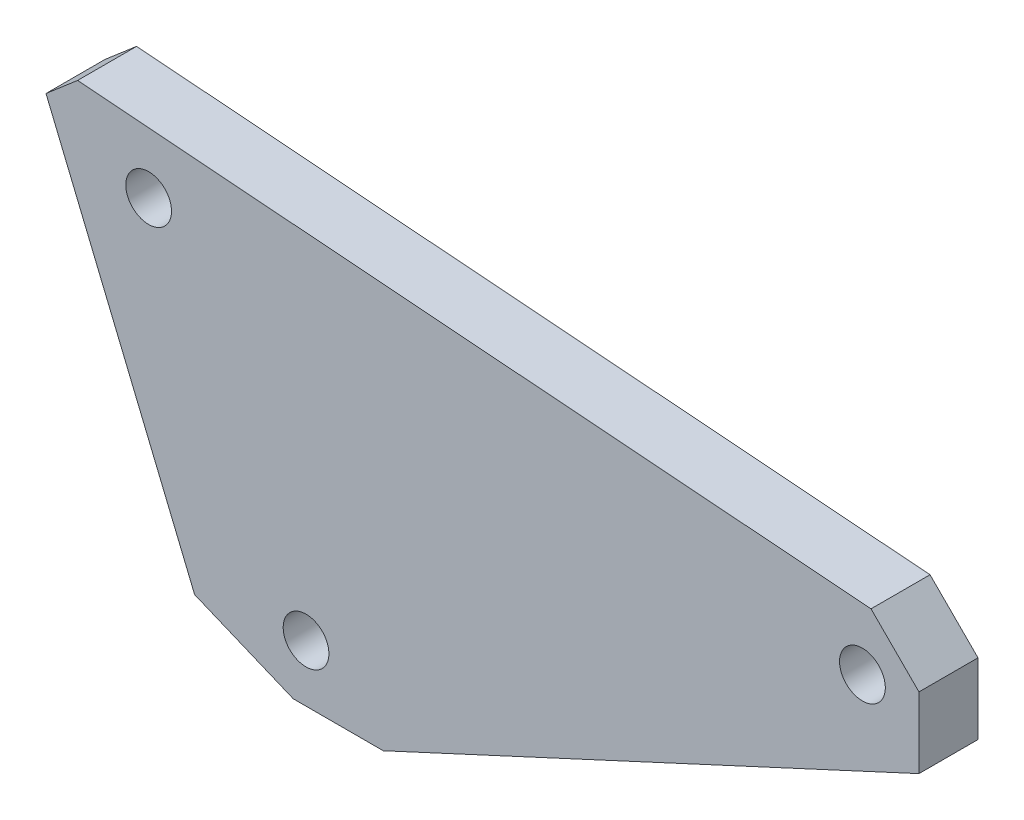
from build123d import *
from OCP.BRepFilletAPI import BRepFilletAPI_MakeChamfer

# Parameters (mm, degrees)
BOSS_EXTRU_1_DEPTH           = 4
ENL_V_MAT_EXTRU_1_DEPTH      = 4
ENL_V_MAT_EXTRU_1_DEPTH_BACK = 7
ESQUISSE2_R                  = 1.55
CHANFREIN1_SIZE              = 3
CHANFREIN1_SIZE2             = 3.25880074
CHANFREIN1_SIZE2_2           = 5.532342211
CHANFREIN1_SIZE2_3           = 2.232526106


with BuildPart() as part:
    # Esquisse1 → Boss.-Extru.1 (new body)
    with BuildSketch(Plane.XY):
        Polygon((-19.694718841, 14.12522617), (-7.625402576, -15.080300035), (4.007307014, -15.080300035), (40.305281159, 1.726159227), (40.305281159, 9.522549697), align=None)
    extrude(amount=BOSS_EXTRU_1_DEPTH)

    # Esquisse2 → Enlèv. mat.-Extru.1 (cut, two sides: drawn at the far end of the back side and taken through both)
    with BuildSketch(Plane.XY.offset(4).offset(-ENL_V_MAT_EXTRU_1_DEPTH_BACK)):
        with Locations(Location((-11.887750079, 9.402917456, 0), (0, 0, 180))):
            Circle(ESQUISSE2_R)
        with Locations(Location((-1.222675499, -11.228701649, 0), (0, 0, 180))):
            Circle(ESQUISSE2_R)
        with Locations(Location((36.47491806, 5.624354462, 0), (0, 0, 180))):
            Circle(ESQUISSE2_R)
    extrude(amount=ENL_V_MAT_EXTRU_1_DEPTH + ENL_V_MAT_EXTRU_1_DEPTH_BACK, mode=Mode.SUBTRACT)

    # Chanfrein1: one chamfer whose edges measure the first distance from different faces: ONE call of the kernel's chamfer builder (chamfer() names one face for all edges)
    chanfrein1_edges_1 = [part.edges().sort_by_distance(p)[0] for p in [
        (40.305281159, 9.522549697, 2),
    ]]
    chanfrein1_side_1 = [part.faces().sort_by_distance(p)[0] for p in [
        (40.305281159, 5.624354462, 2),
    ]]
    chanfrein1_edges_2 = [part.edges().sort_by_distance(p)[0] for p in [
        (-7.625402576, -15.080300035, 2),
    ]]
    chanfrein1_side_2 = [part.faces().sort_by_distance(p)[0] for p in [
        (-13.660060709, -0.477536933, 2),
    ]]
    chanfrein1_edges_3 = [part.edges().sort_by_distance(p)[0] for p in [
        (-19.694718841, 14.12522617, 2),
    ]]
    chanfrein1_side_3 = [part.faces().sort_by_distance(p)[0] for p in [
        (10.305281159, 11.823887933, 2),
    ]]
    chanfrein1 = BRepFilletAPI_MakeChamfer(part.part.solid().wrapped)
    for e in chanfrein1_edges_1:
        chanfrein1.Add(CHANFREIN1_SIZE, CHANFREIN1_SIZE2, e.wrapped, chanfrein1_side_1[0].wrapped)  # the first distance lies on this face
    for e in chanfrein1_edges_2:
        chanfrein1.Add(CHANFREIN1_SIZE, CHANFREIN1_SIZE2_2, e.wrapped, chanfrein1_side_2[0].wrapped)  # the first distance lies on this face
    for e in chanfrein1_edges_3:
        chanfrein1.Add(CHANFREIN1_SIZE, CHANFREIN1_SIZE2_3, e.wrapped, chanfrein1_side_3[0].wrapped)  # the first distance lies on this face
    add(Compound.cast(chanfrein1.Shape()), mode=Mode.REPLACE)


solid = part.part
